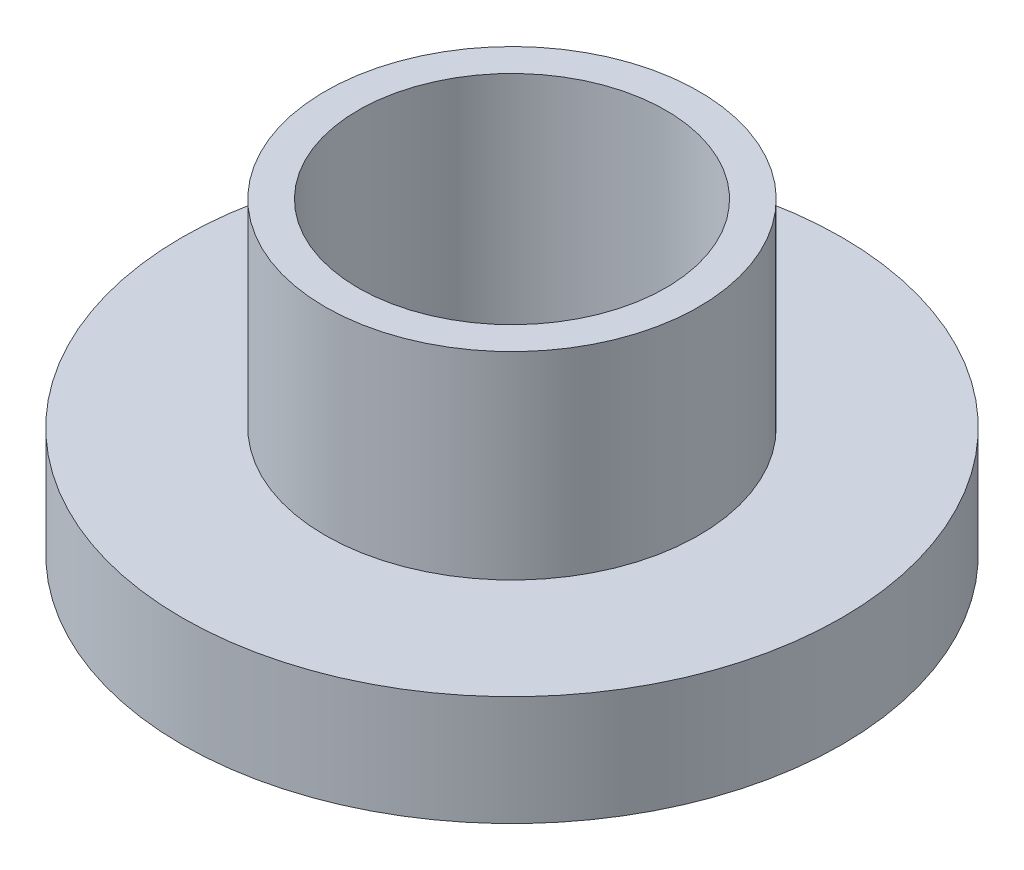
from build123d import *

# Parameters (mm, degrees)
SKETCH_1_R          = 3
EXTRUDE_1_DEPTH     = 2.8
SKETCH_2_R          = 1.4
CUT_EXTRUDE_1_DEPTH = 6.083306011
SKETCH_3_OUTSIDE_W  = 9.788
SKETCH_3_OUTSIDE_H  = 9.788
SKETCH_3_OUTSIDE_R  = 1.7
CUT_EXTRUDE_2_DEPTH = 1.8


with BuildPart() as part:
    # 草图1 → 拉伸1 (new body)
    with BuildSketch(Plane(origin=(0, 0, 0), x_dir=(1, 0, 0), z_dir=(0, 1, 0))):
        with Locations(Location((0, 0, 0), (0, 0, 270))):
            Circle(SKETCH_1_R)
    extrude(amount=EXTRUDE_1_DEPTH)

    # 草图2 → 切除-拉伸1 (cut, through all)
    with BuildSketch(Plane(origin=(0, 2.8, 0), x_dir=(-1, 0, 0), z_dir=(0, 1, 0))):
        with Locations(Location((0, 0, 0), (0, 0, 90))):
            Circle(SKETCH_2_R)
    extrude(amount=-CUT_EXTRUDE_1_DEPTH, mode=Mode.SUBTRACT)

    # 草图3 outside → 切除-拉伸2 (cut)
    with BuildSketch(Plane(origin=(0, 2.8, 0), x_dir=(1, 0, 0), z_dir=(0, 1, 0))):
        Rectangle(SKETCH_3_OUTSIDE_W, SKETCH_3_OUTSIDE_H)
        with Locations(Location((0, 0, 0), (0, 0, 270))):
            Circle(SKETCH_3_OUTSIDE_R, mode=Mode.SUBTRACT)
    extrude(amount=-CUT_EXTRUDE_2_DEPTH, mode=Mode.SUBTRACT)


solid = part.part
